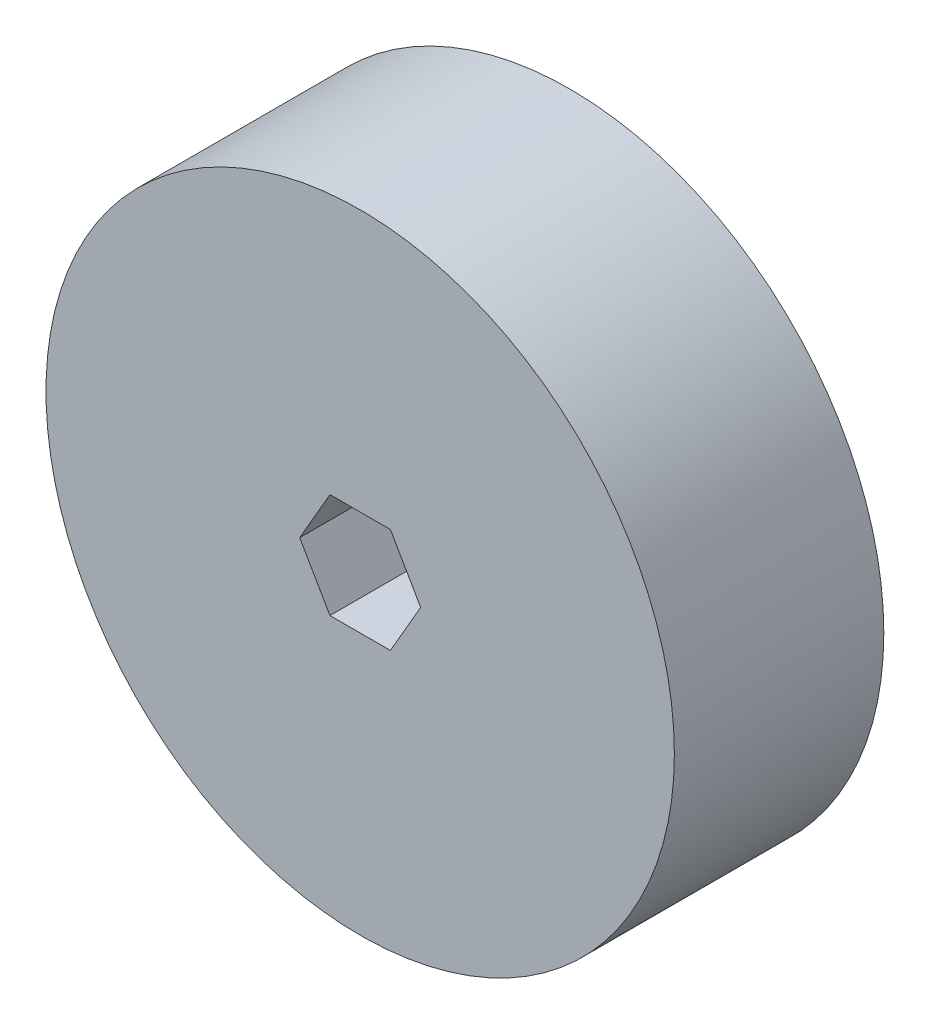
from build123d import *

# Parameters (mm, degrees)
SKETCH1_R           = 38.1
BOSS_EXTRUDE1_DEPTH = 25.4


with BuildPart() as part:
    # Sketch1 → Boss-Extrude1 (new body)
    with BuildSketch(Plane.XY):
        Circle(SKETCH1_R)
        Polygon((-7.332348419, 0), (-3.666174209, -6.35), (3.666174209, -6.35), (7.332348419, 0), (3.666174209, 6.35), (-3.666174209, 6.35), align=None, mode=Mode.SUBTRACT)
    extrude(amount=BOSS_EXTRUDE1_DEPTH)


solid = part.part
